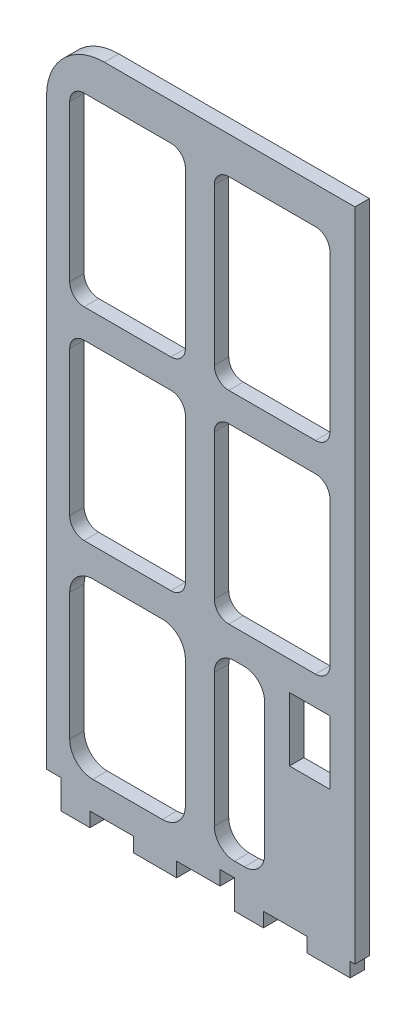
from build123d import *

# Parameters (mm, degrees)
BOSS_EXTRUDE1_DEPTH = 6.35
CUT_EXTRUDE1_DEPTH  = 319.315227787
SKETCH3_W           = 6.35
SKETCH3_H           = 12.7
CUT_EXTRUDE2_DEPTH  = 319.315227787
SKETCH4_W           = 58.894470958
SKETCH4_H           = 80.433020337
BOSS_EXTRUDE3_DEPTH = 6.35
SKETCH6_W           = 17.78
SKETCH6_H           = 27.94
CUT_EXTRUDE3_DEPTH  = 319.315227787
CUT_EXTRUDE4_DEPTH  = 6.35


with BuildPart() as part:
    # Sketch1 → Boss-Extrude1 (new body)
    with BuildSketch(Plane.XY):
        with BuildLine():
            Line((133.35, 0), (135.457692, 0))
            Line((135.457692, 0), (135.457692, 287.9852))
            Line((135.457692, 287.9852), (25.4, 287.9852))
            ThreePointArc((25.4, 287.9852), (7.439487758, 280.545712242), (0, 262.5852))
            Line((0, 262.5852), (0, 0))
            Line((0, 0), (0, -6.35))
            Line((0, -6.35), (19.05, -6.35))
            Line((19.05, -6.35), (19.05, 0))
            Line((19.05, 0), (38.1, 0))
            Line((38.1, 0), (38.1, -6.35))
            Line((38.1, -6.35), (57.15, -6.35))
            Line((57.15, -6.35), (57.15, 0))
            Line((57.15, 0), (76.2, 0))
            Line((76.2, 0), (76.2, -6.35))
            Line((76.2, -6.35), (95.25, -6.35))
            Line((95.25, -6.35), (95.25, 0))
            Line((95.25, 0), (114.3, 0))
            Line((114.3, 0), (114.3, -6.35))
            Line((114.3, -6.35), (133.35, -6.35))
            Line((133.35, -6.35), (133.35, 0))
        make_face()
    extrude(amount=BOSS_EXTRUDE1_DEPTH)

    # Sketch2 → Cut-Extrude1 (cut, through all)
    with BuildSketch(Plane.XY.offset(6.35)):
        with BuildLine():
            Line((73.66, 22.86), (73.66, 78.74))
            ThreePointArc((73.66, 78.74), (76.635795103, 85.924204897), (83.82, 88.9))
            Line((83.82, 88.9), (114.3, 88.9))
            ThreePointArc((114.3, 88.9), (121.484204897, 85.924204897), (124.46, 78.74))
            Line((124.46, 78.74), (124.46, 22.86))
            ThreePointArc((124.46, 22.86), (121.484204897, 15.675795103), (114.3, 12.7))
            Line((114.3, 12.7), (83.82, 12.7))
            ThreePointArc((83.82, 12.7), (76.635795103, 15.675795103), (73.66, 22.86))
        make_face()
        with BuildLine():
            Line((20.32, 12.7), (50.8, 12.7))
            ThreePointArc((50.8, 12.7), (57.984204897, 15.675795103), (60.96, 22.86))
            Line((60.96, 22.86), (60.96, 78.74))
            ThreePointArc((60.96, 78.74), (57.984204897, 85.924204897), (50.8, 88.9))
            Line((50.8, 88.9), (20.32, 88.9))
            ThreePointArc((20.32, 88.9), (13.135795103, 85.924204897), (10.16, 78.74))
            Line((10.16, 78.74), (10.16, 22.86))
            ThreePointArc((10.16, 22.86), (13.135795103, 15.675795103), (20.32, 12.7))
        make_face()
        with BuildLine():
            Line((73.66, 196.85), (73.66, 265.43))
            ThreePointArc((73.66, 265.43), (75.519871939, 269.920128061), (80.01, 271.78))
            Line((80.01, 271.78), (118.11, 271.78))
            ThreePointArc((118.11, 271.78), (122.600128061, 269.920128061), (124.46, 265.43))
            Line((124.46, 265.43), (124.46, 196.85))
            ThreePointArc((124.46, 196.85), (122.600128061, 192.359871939), (118.11, 190.5))
            Line((118.11, 190.5), (80.01, 190.5))
            ThreePointArc((80.01, 190.5), (75.519871939, 192.359871939), (73.66, 196.85))
        make_face()
        with BuildLine():
            Line((10.16, 196.85), (10.16, 265.43))
            ThreePointArc((10.16, 265.43), (12.019871939, 269.920128061), (16.51, 271.78))
            Line((16.51, 271.78), (54.61, 271.78))
            ThreePointArc((54.61, 271.78), (59.100128061, 269.920128061), (60.96, 265.43))
            Line((60.96, 265.43), (60.96, 196.85))
            ThreePointArc((60.96, 196.85), (59.100128061, 192.359871939), (54.61, 190.5))
            Line((54.61, 190.5), (16.51, 190.5))
            ThreePointArc((16.51, 190.5), (12.019871939, 192.359871939), (10.16, 196.85))
        make_face()
        with BuildLine():
            Line((73.66, 107.95), (73.66, 171.45))
            ThreePointArc((73.66, 171.45), (75.519871939, 175.940128061), (80.01, 177.8))
            Line((80.01, 177.8), (118.11, 177.8))
            ThreePointArc((118.11, 177.8), (122.600128061, 175.940128061), (124.46, 171.45))
            Line((124.46, 171.45), (124.46, 107.95))
            ThreePointArc((124.46, 107.95), (122.600128061, 103.459871939), (118.11, 101.6))
            Line((118.11, 101.6), (80.01, 101.6))
            ThreePointArc((80.01, 101.6), (75.519871939, 103.459871939), (73.66, 107.95))
        make_face()
        with BuildLine():
            Line((10.16, 107.95), (10.16, 171.45))
            ThreePointArc((10.16, 171.45), (12.019871939, 175.940128061), (16.51, 177.8))
            Line((16.51, 177.8), (54.61, 177.8))
            ThreePointArc((54.61, 177.8), (59.100128061, 175.940128061), (60.96, 171.45))
            Line((60.96, 171.45), (60.96, 107.95))
            ThreePointArc((60.96, 107.95), (59.100128061, 103.459871939), (54.61, 101.6))
            Line((54.61, 101.6), (16.51, 101.6))
            ThreePointArc((16.51, 101.6), (12.019871939, 103.459871939), (10.16, 107.95))
        make_face()
    extrude(amount=-CUT_EXTRUDE1_DEPTH, mode=Mode.SUBTRACT)

    # Sketch3 → Cut-Extrude2 (cut, through all)
    with BuildSketch(Plane.XY.offset(6.35)):
        with Locations((3.175, 0)):
            Rectangle(SKETCH3_W, SKETCH3_H)
        with Locations((79.375, 0)):
            Rectangle(SKETCH3_W, SKETCH3_H)
    extrude(amount=-CUT_EXTRUDE2_DEPTH, mode=Mode.SUBTRACT)

    # Sketch4 → Boss-Extrude3 (add)
    with BuildSketch(Plane.XY.offset(6.35)):
        with Locations((98.603069985, 49.657450477)):
            Rectangle(SKETCH4_W, SKETCH4_H)
    extrude(amount=-BOSS_EXTRUDE3_DEPTH)

    # Sketch6 → Cut-Extrude3 (cut, through all)
    with BuildSketch(Plane(origin=(0, 0, 0), x_dir=(-1, 0, 0), z_dir=(0, 0, -1))):
        with Locations((-115.57, 74.93)):
            Rectangle(SKETCH6_W, SKETCH6_H)
    extrude(amount=-CUT_EXTRUDE3_DEPTH, mode=Mode.SUBTRACT)

    # Sketch7 → Cut-Extrude4 (cut)
    with BuildSketch(Plane.XY.offset(6.35)):
        with BuildLine():
            Line((82.55, 88.9), (86.868, 88.9))
            ThreePointArc((86.868, 88.9), (93.154179285, 86.296179285), (95.758, 80.01))
            Line((95.758, 80.01), (95.758, 21.59))
            ThreePointArc((95.758, 21.59), (93.154179285, 15.303820715), (86.868, 12.7))
            Line((86.868, 12.7), (82.55, 12.7))
            ThreePointArc((82.55, 12.7), (76.263820715, 15.303820715), (73.66, 21.59))
            Line((73.66, 21.59), (73.66, 80.01))
            ThreePointArc((73.66, 80.01), (76.263820715, 86.296179285), (82.55, 88.9))
        make_face()
    extrude(amount=-CUT_EXTRUDE4_DEPTH, mode=Mode.SUBTRACT)


solid = part.part
